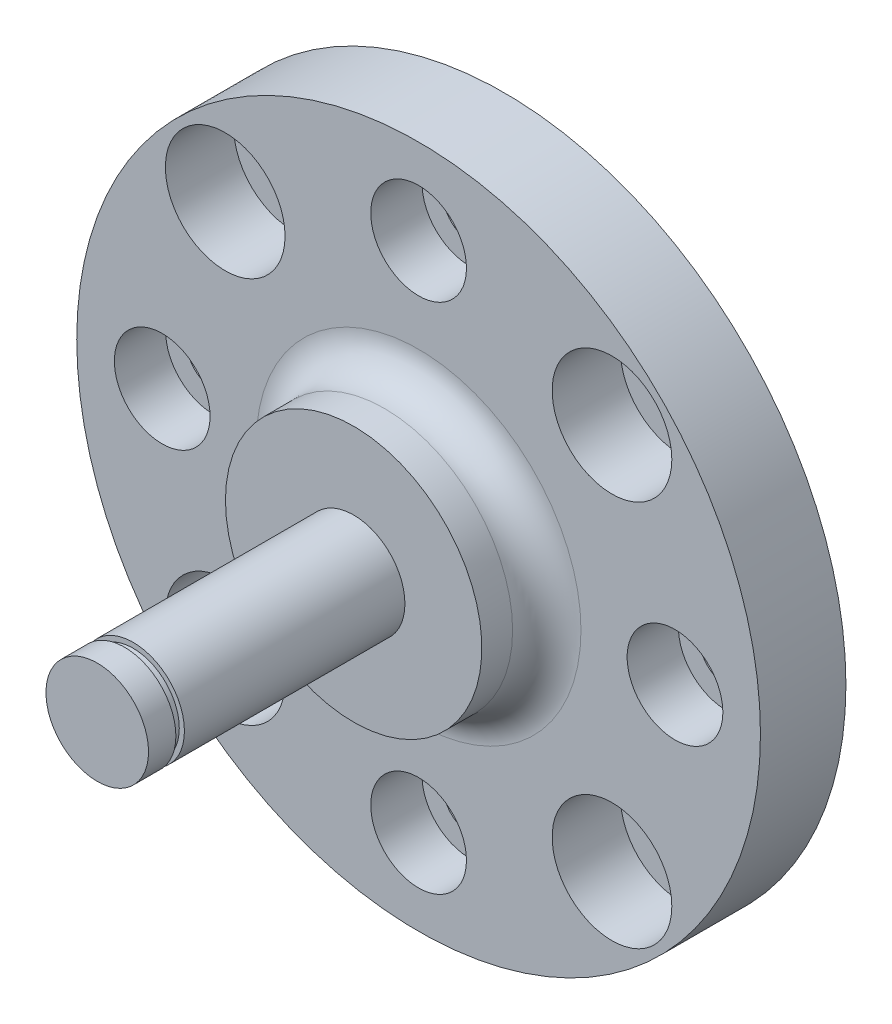
from build123d import *

# Parameters (mm, degrees)
SKETCH_1_R          = 20
SKETCH_1_R_2        = 1.55
SKETCH_1_R_3        = 2.05
EXTRUDE_1_DEPTH     = 5
SKETCH_2_R          = 2.8
CUT_EXTRUDE_1_DEPTH = 3
SKETCH_3_R          = 3.5
CUT_EXTRUDE_2_DEPTH = 4
SKETCH_5_R          = 7.5
EXTRUDE_3_DEPTH     = 3.8
SKETCH_6_R          = 3
EXTRUDE_4_DEPTH     = 15
FILLET_1_R          = 2
SKETCH_7_R          = 3
SKETCH_7_R_2        = 2.7
CUT_EXTRUDE_3_DEPTH = 0.5


with BuildPart() as part:
    # 草图1 → 凸台-拉伸1 (new body)
    with BuildSketch(Plane.XY):
        Circle(SKETCH_1_R)
        with Locations((0, 15)):
            Circle(SKETCH_1_R_2, mode=Mode.SUBTRACT)
        with Locations((-11.313708499, 11.313708499)):
            Circle(SKETCH_1_R_3, mode=Mode.SUBTRACT)
        with Locations((11.313708499, 11.313708499)):
            Circle(SKETCH_1_R_3, mode=Mode.SUBTRACT)
        with Locations((15, 0)):
            Circle(SKETCH_1_R_2, mode=Mode.SUBTRACT)
        with Locations((11.313708499, -11.313708499)):
            Circle(SKETCH_1_R_3, mode=Mode.SUBTRACT)
        with Locations((0, -15)):
            Circle(SKETCH_1_R_2, mode=Mode.SUBTRACT)
        with Locations((-11.313708499, -11.313708499)):
            Circle(SKETCH_1_R_3, mode=Mode.SUBTRACT)
        with Locations((-15, 0)):
            Circle(SKETCH_1_R_2, mode=Mode.SUBTRACT)
    extrude(amount=EXTRUDE_1_DEPTH)

    # 草图2 → 切除-拉伸1 (cut)
    with BuildSketch(Plane.XY.offset(5)):
        with Locations((0, 15)):
            Circle(SKETCH_2_R)
        with Locations((15, 0)):
            Circle(SKETCH_2_R)
        with Locations((0, -15)):
            Circle(SKETCH_2_R)
        with Locations((-15, 0)):
            Circle(SKETCH_2_R)
    extrude(amount=-CUT_EXTRUDE_1_DEPTH, mode=Mode.SUBTRACT)

    # 草图3 → 切除-拉伸2 (cut)
    with BuildSketch(Plane.XY.offset(5)):
        with Locations((-11.313708499, 11.313708499)):
            Circle(SKETCH_3_R)
        with Locations((11.313708499, 11.313708499)):
            Circle(SKETCH_3_R)
        with Locations((11.313708499, -11.313708499)):
            Circle(SKETCH_3_R)
        with Locations((-11.313708499, -11.313708499)):
            Circle(SKETCH_3_R)
    extrude(amount=-CUT_EXTRUDE_2_DEPTH, mode=Mode.SUBTRACT)

    # 草图5 → 凸台-拉伸3 (add)
    with BuildSketch(Plane.XY.offset(5)):
        with Locations(Location((0, 0, 0), (0, 0, 180))):
            Circle(SKETCH_5_R)
    extrude(amount=EXTRUDE_3_DEPTH)

    # 草图6 → 凸台-拉伸4 (add)
    with BuildSketch(Plane.XY.offset(8.8)):
        Circle(SKETCH_6_R)
    extrude(amount=EXTRUDE_4_DEPTH)

    # 圆角1
    fillet_1_edges = [part.edges().sort_by_distance(p)[0] for p in [
        (7.5, 0, 5),
    ]]
    fillet(fillet_1_edges, radius=FILLET_1_R)

    # 草图7 → 切除-拉伸3 (cut)
    with BuildSketch(Plane.XY.offset(21.7)):
        Circle(SKETCH_7_R)
        Circle(SKETCH_7_R_2, mode=Mode.SUBTRACT)
    extrude(amount=CUT_EXTRUDE_3_DEPTH, mode=Mode.SUBTRACT)


solid = part.part
